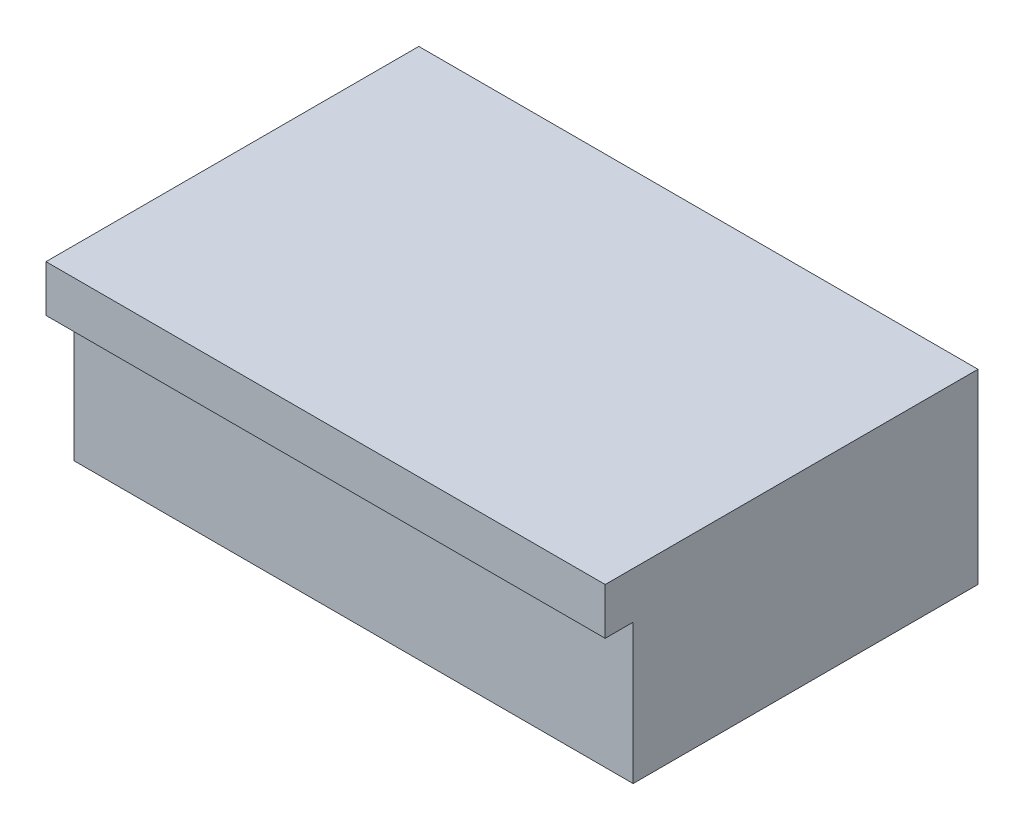
from build123d import *

# Parameters (mm, degrees)
SKETCH_1_W          = 30
SKETCH_1_H          = 20
EXTRUDE_1_DEPTH     = 10
SKETCH_2_W          = 30
SKETCH_2_H          = 7.5
CUT_EXTRUDE_1_DEPTH = 1.5


with BuildPart() as part:
    # 草图1 → 凸台-拉伸1 (new body)
    with BuildSketch(Plane(origin=(0, 0, 0), x_dir=(1, 0, 0), z_dir=(0, 1, 0))):
        with Locations((15, 10)):
            Rectangle(SKETCH_1_W, SKETCH_1_H)
    extrude(amount=EXTRUDE_1_DEPTH)

    # 草图2 → 切除-拉伸1 (cut)
    with BuildSketch(Plane.XY):
        with Locations((15, 3.75)):
            Rectangle(SKETCH_2_W, SKETCH_2_H)
    extrude(amount=-CUT_EXTRUDE_1_DEPTH, mode=Mode.SUBTRACT)


solid = part.part
